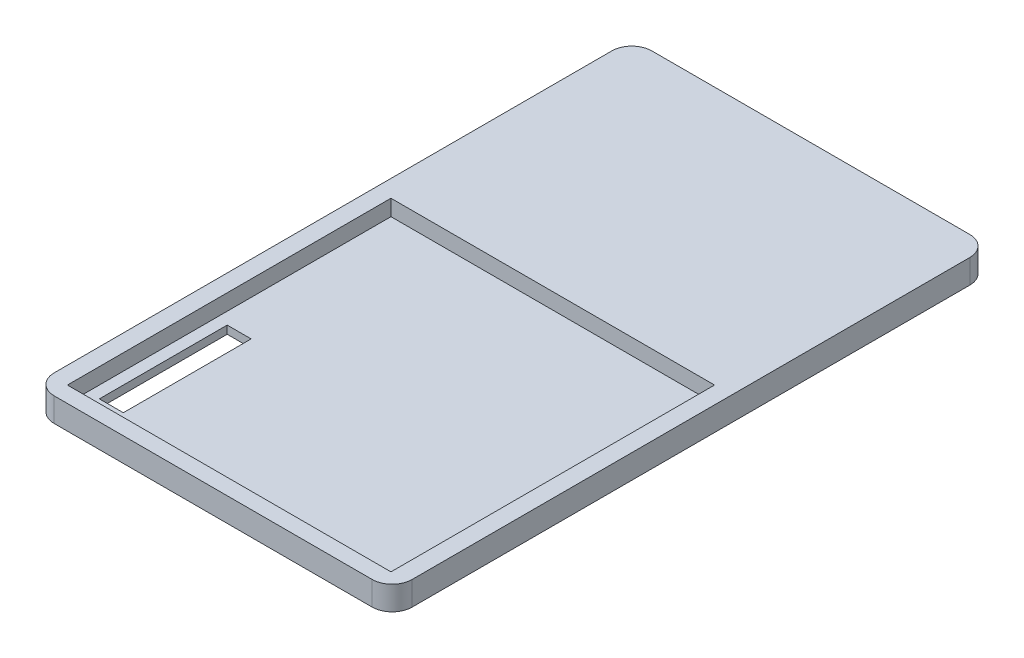
from build123d import *

# Parameters (mm, degrees)
SKETCH1_W           = 40.5
SKETCH1_H           = 40.5
BOSS_EXTRUDE1_DEPTH = 3
SKETCH1_3_W         = 40.5
SKETCH1_3_H         = 40.5
SKETCH1_3_W_2       = 3
SKETCH1_3_H_2       = 16
BOSS_EXTRUDE2_DEPTH = 1


with BuildPart() as part:
    # Sketch1 → Boss-Extrude1 (new body)
    with BuildSketch(Plane(origin=(0, 0, 0), x_dir=(1, 0, 0), z_dir=(0, 1, 0))):
        with BuildLine():
            Line((19.9, 37.4), (-19.9, 37.4))
            ThreePointArc((-19.9, 37.4), (-21.667766953, 36.667766953), (-22.4, 34.9))
            Line((-22.4, 34.9), (-22.4, -34.9))
            ThreePointArc((-22.4, -34.9), (-21.667766953, -36.667766953), (-19.9, -37.4))
            Line((-19.9, -37.4), (19.9, -37.4))
            ThreePointArc((19.9, -37.4), (21.667766953, -36.667766953), (22.4, -34.9))
            Line((22.4, -34.9), (22.4, 34.9))
            ThreePointArc((22.4, 34.9), (21.667766953, 36.667766953), (19.9, 37.4))
        make_face()
        with Locations((0, -15.15)):
            Rectangle(SKETCH1_W, SKETCH1_H, mode=Mode.SUBTRACT)
    extrude(amount=BOSS_EXTRUDE1_DEPTH)

    # Sketch1<3> → Boss-Extrude2 (add)
    with BuildSketch(Plane(origin=(0, 0, 0), x_dir=(1, 0, 0), z_dir=(0, 1, 0))):
        with Locations((0, -15.15)):
            Rectangle(SKETCH1_3_W, SKETCH1_3_H)
        with Locations((-17.25, -24.9)):
            Rectangle(SKETCH1_3_W_2, SKETCH1_3_H_2, mode=Mode.SUBTRACT)
    extrude(amount=BOSS_EXTRUDE2_DEPTH)


solid = part.part
